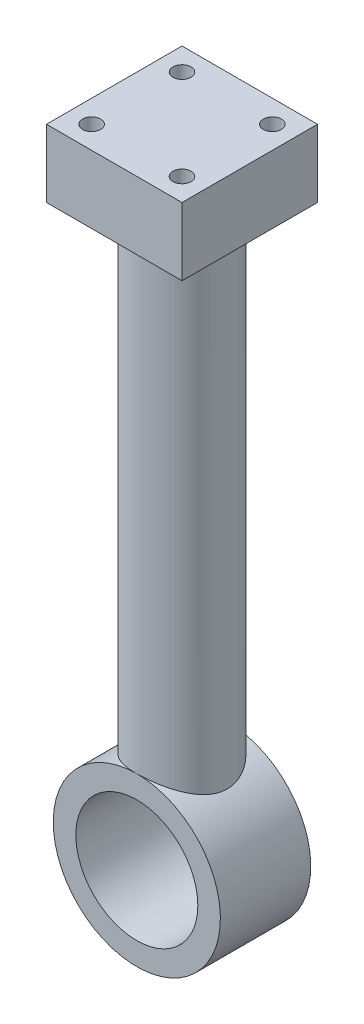
from build123d import *

# Parameters (mm, degrees)
SKETCH_1_R           = 18.5
SKETCH_1_R_2         = 13.5
EXTRUDE_1_DEPTH      = 10
EXTRUDE_2_REACH      = 145.054
EXTRUDE_2_END_RADIUS = 18.5
SKETCH_3_R           = 10
SKETCH_4_W           = 30
SKETCH_4_H           = 30
EXTRUDE_3_DEPTH      = 15
SKETCH_5_R           = 2
CUT_EXTRUDE_1_DEPTH  = 15
SKETCH_6_R           = 4.5
CUT_EXTRUDE_2_DEPTH  = 1.5


with BuildPart() as part:
    # 草图1 → 凸台-拉伸1 (new, symmetric)
    with BuildSketch(Plane.XY):
        Circle(SKETCH_1_R)
        Circle(SKETCH_1_R_2, mode=Mode.SUBTRACT)
    extrude(amount=EXTRUDE_1_DEPTH, both=True)

    # 凸台-拉伸2: up to this cylinder (the profile starts outside it)
    extrude_2_end = Plane(origin=(0, 0, 0), z_dir=(0, 0, -1)) * Cylinder(EXTRUDE_2_END_RADIUS, 328.108, mode=Mode.PRIVATE)
    # 草图3 → 凸台-拉伸2 (add, up to the surface)
    with BuildSketch(Plane(origin=(0, 123, 0), x_dir=(1, 0, 0), z_dir=(0, 1, 0)), mode=Mode.PRIVATE) as extrude_2_sk1:
        with Locations(Location((0, 0, 0), (0, 0, 270))):
            Circle(SKETCH_3_R)
    extrude_2_tool1 = extrude(extrude_2_sk1.sketch, amount=-EXTRUDE_2_REACH, mode=Mode.PRIVATE) - extrude_2_end
    add(extrude_2_tool1.solids().sort_by_distance((0, 123, 0))[0])

    # 草图4 → 凸台-拉伸3 (add)
    with BuildSketch(Plane(origin=(0, 123, 0), x_dir=(1, 0, 0), z_dir=(0, 1, 0))):
        Rectangle(SKETCH_4_W, SKETCH_4_H)
    extrude(amount=EXTRUDE_3_DEPTH)

    # 草图5 → 切除-拉伸1 (cut)
    with BuildSketch(Plane(origin=(0, 138, 0), x_dir=(1, 0, 0), z_dir=(0, 1, 0))):
        with Locations(Location((-10, 10, 0), (0, 0, 270))):
            Circle(SKETCH_5_R)
        with Locations(Location((10, 10, 0), (0, 0, 270))):
            Circle(SKETCH_5_R)
        with Locations(Location((-10, -10, 0), (0, 0, 270))):
            Circle(SKETCH_5_R)
        with Locations(Location((10, -10, 0), (0, 0, 270))):
            Circle(SKETCH_5_R)
    extrude(amount=-CUT_EXTRUDE_1_DEPTH, mode=Mode.SUBTRACT)

    # 草图6 → 切除-拉伸2 (cut)
    with BuildSketch(Plane.XZ.offset(-123)):
        with Locations(Location((-10, -10, 0), (0, 0, 270))):
            Circle(SKETCH_6_R)
        with Locations(Location((-10, 10, 0), (0, 0, 270))):
            Circle(SKETCH_6_R)
        with Locations(Location((10, 10, 0), (0, 0, 270))):
            Circle(SKETCH_6_R)
        with Locations(Location((10, -10, 0), (0, 0, 270))):
            Circle(SKETCH_6_R)
    extrude(amount=-CUT_EXTRUDE_2_DEPTH, mode=Mode.SUBTRACT)


solid = part.part
